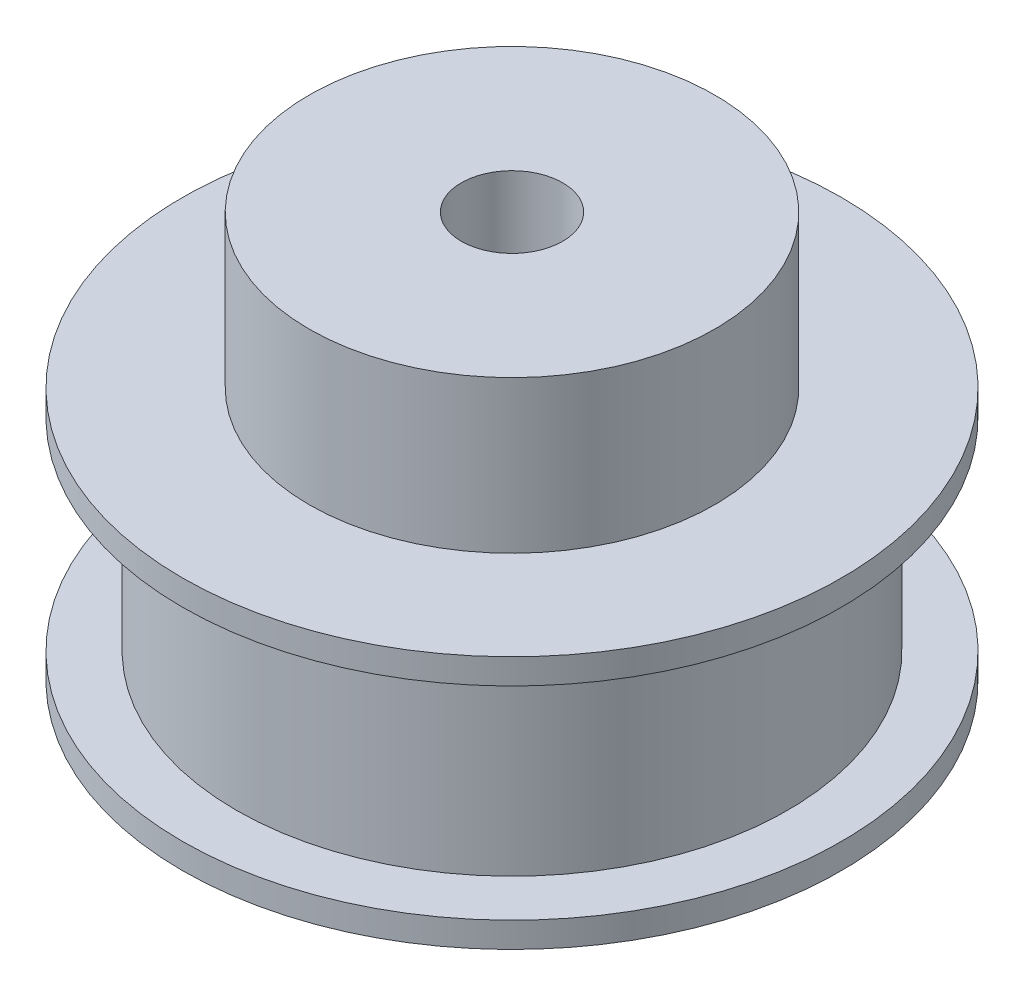
from build123d import *

# Parameters (mm, degrees)
ESQUISSE1_R      = 13
EXTRUSION1_DEPTH = 1
ESQUISSE2_R      = 10.875
EXTRUSION2_DEPTH = 8
ESQUISSE3_R      = 13
EXTRUSION3_DEPTH = 1
ESQUISSE4_R      = 8
EXTRUSION4_DEPTH = 6
ESQUISSE5_R      = 2
EXTRUSION5_DEPTH = 25.372115214


with BuildPart() as part:
    # Esquisse1 → Extrusion1 (new body)
    with BuildSketch(Plane(origin=(0, 0, 0), x_dir=(1, 0, 0), z_dir=(0, 1, 0))):
        with Locations(Location((0, 0, 0), (0, 0, 270))):
            Circle(ESQUISSE1_R)
    extrude(amount=EXTRUSION1_DEPTH)

    # Esquisse2 → Extrusion2 (add)
    with BuildSketch(Plane(origin=(0, 1, 0), x_dir=(-1, 0, 0), z_dir=(0, 1, 0))):
        with Locations(Location((0, 0, 0), (0, 0, 90))):
            Circle(ESQUISSE2_R)
    extrude(amount=EXTRUSION2_DEPTH)

    # Esquisse3 → Extrusion3 (add)
    with BuildSketch(Plane(origin=(0, 9, 0), x_dir=(-1, 0, 0), z_dir=(0, 1, 0))):
        with Locations(Location((0, 0, 0), (0, 0, 90))):
            Circle(ESQUISSE3_R)
    extrude(amount=EXTRUSION3_DEPTH)

    # Esquisse4 → Extrusion4 (add)
    with BuildSketch(Plane(origin=(0, 10, 0), x_dir=(-1, 0, 0), z_dir=(0, 1, 0))):
        with Locations(Location((0, 0, 0), (0, 0, 90))):
            Circle(ESQUISSE4_R)
    extrude(amount=EXTRUSION4_DEPTH)

    # Esquisse5 → Extrusion5 (cut, through all)
    with BuildSketch(Plane(origin=(0, 16, 0), x_dir=(-1, 0, 0), z_dir=(0, 1, 0))):
        with Locations(Location((0, 0, 0), (0, 0, 90))):
            Circle(ESQUISSE5_R)
    extrude(amount=-EXTRUSION5_DEPTH, mode=Mode.SUBTRACT)


solid = part.part
